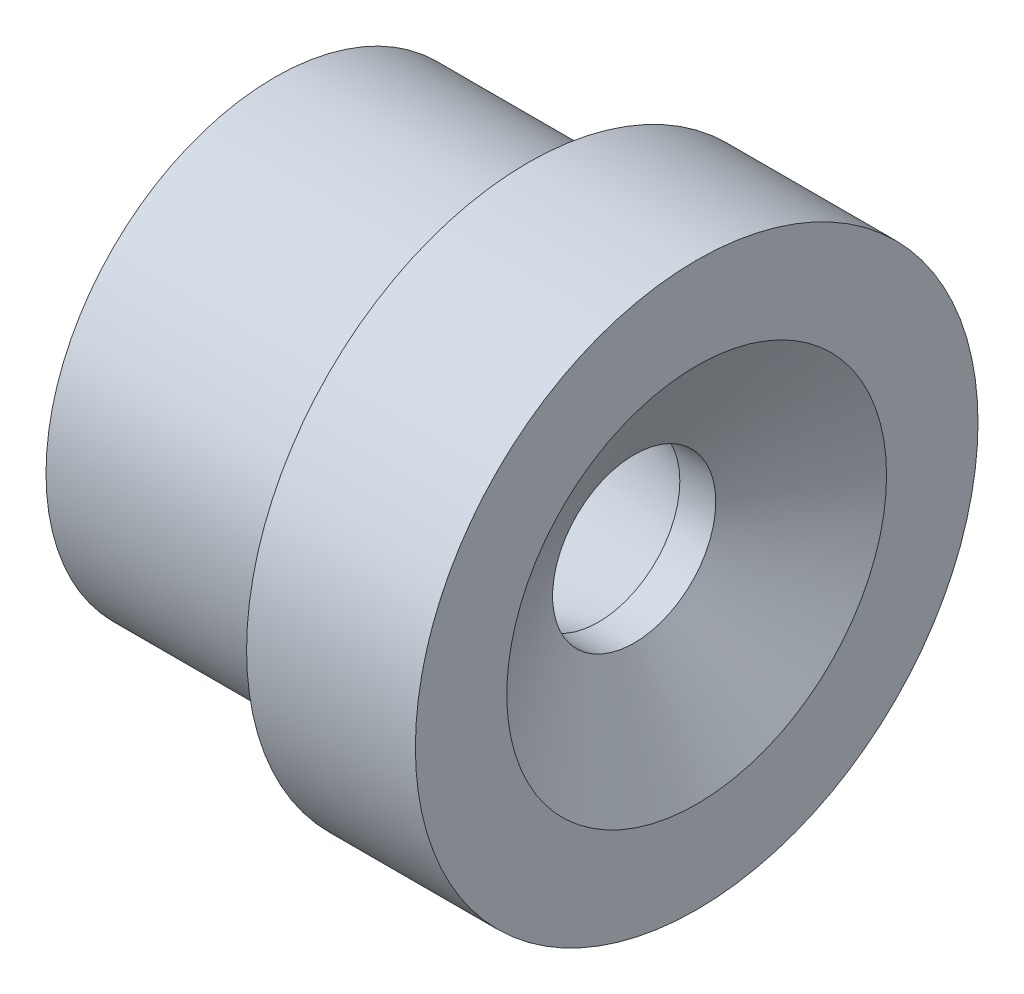
from build123d import *


with BuildPart() as part:
    # Sketch1 → Revolve1 (revolve)
    with BuildSketch(Plane(origin=(0, 0, 0), x_dir=(1, 0, 0), z_dir=(0, 1, 0)), mode=Mode.PRIVATE) as revolve1_sk:
        Polygon((0, 0), (0, 4.1275), (-2.822954141, 9.017), (-4.443474141, 9.017), (-19.05, 5.103193192), (-19.05, 2.3749), (-7.62, 2.3749), (-7.62, 0), align=None)
    revolve(revolve1_sk.sketch.rotate(Axis((5.118729701, 0, -12.7), (-1, 0, 0)), 180), axis=Axis((5.118729701, 0, -12.7), (-1, 0, 0)))


solid = part.part
